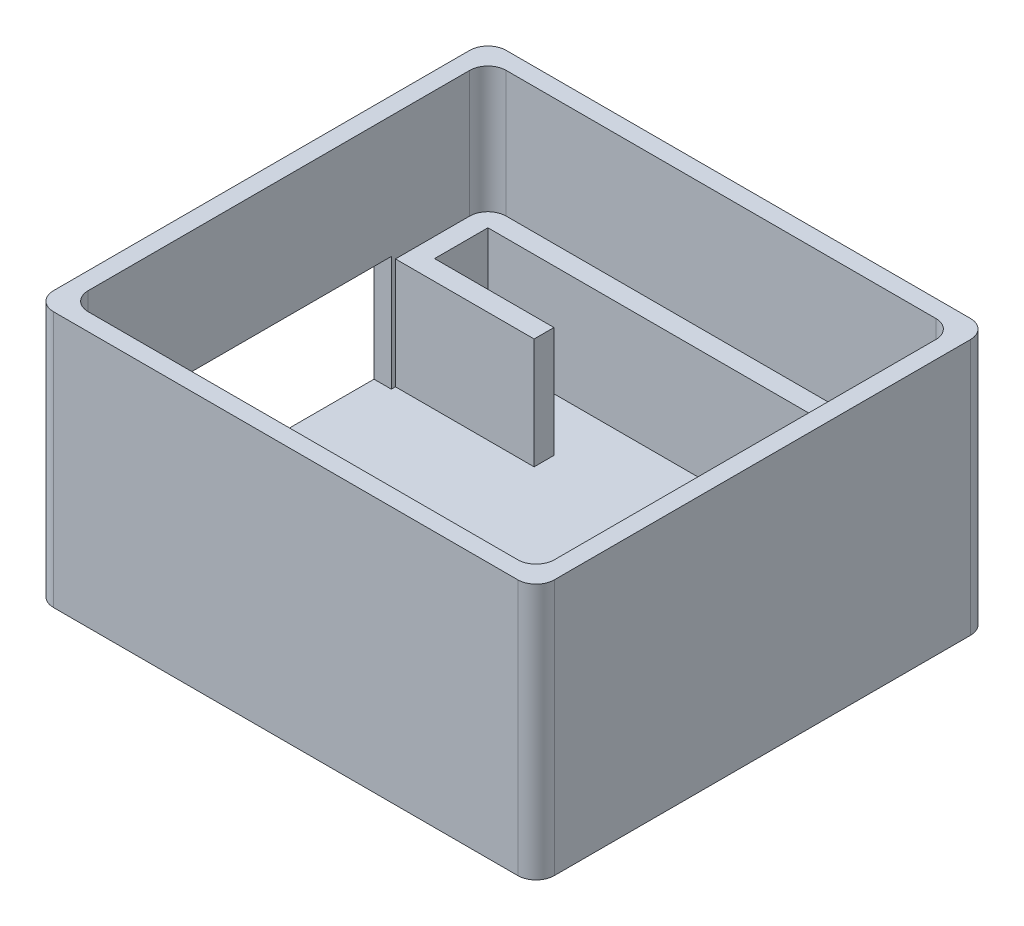
from build123d import *

# Parameters (mm, degrees)
SKETCH_1_W          = 26
SKETCH_1_H          = 23.5
SKETCH_1_W_2        = 24
SKETCH_1_H_2        = 21.5
EXTRUDE_1_DEPTH     = 10
SKETCH_2_W          = 12.504676962
SKETCH_2_H          = 3.66933463
CUT_EXTRUDE_1_DEPTH = 1
EXTRUDE_2_DEPTH     = 2.3
SKETCH_5_W          = 26
SKETCH_5_H          = 23.5
EXTRUDE_3_DEPTH     = 1
CUT_EXTRUDE_2_REACH = 38.168
SKETCH_6_W          = 24.2
SKETCH_6_H          = 21.7
SKETCH_6_W_2        = 24
SKETCH_6_H_2        = 21.5
SKETCH_7_W          = 22.2
SKETCH_7_H          = 1
SKETCH_7_W_2        = 1
SKETCH_7_H_2        = 19.7
SKETCH_7_W_3        = 6.19724131
SKETCH_7_H_3        = 1.03
SKETCH_7_W_4        = 6.2
EXTRUDE_4_DEPTH     = 5.75
FILLET_1_R          = 0.95


with BuildPart() as part:
    # 草图1 → 凸台-拉伸1 (new body)
    with BuildSketch(Plane(origin=(0, 0, 0), x_dir=(1, 0, 0), z_dir=(0, 1, 0))):
        with Locations((12, 10.75)):
            Rectangle(SKETCH_1_W, SKETCH_1_H)
        with Locations((12, 10.75)):
            Rectangle(SKETCH_1_W_2, SKETCH_1_H_2, mode=Mode.SUBTRACT)
    extrude(amount=EXTRUDE_1_DEPTH)

    # 草图2 → 切除-拉伸1 (cut)
    with BuildSketch(Plane.ZY.offset(1)):
        with Locations((-10.334237592, 1.834667315)):
            Rectangle(SKETCH_2_W, SKETCH_2_H)
    extrude(amount=-CUT_EXTRUDE_1_DEPTH, mode=Mode.SUBTRACT)

    # 草图3 → 凸台-拉伸2 (add)
    with BuildSketch(Plane.XZ):
        Polygon((-1, -4.081899111), (-1, 1), (25, 1), (25, -22.5), (-1, -22.5), (-1, -16.586576073), (0, -16.586576073), (0, -21.5), (24, -21.5), (24, 0), (0, 0), (0, -4.081899111), align=None)
    extrude(amount=EXTRUDE_2_DEPTH)

    # 草图5 → 凸台-拉伸3 (add)
    with BuildSketch(Plane.XZ.offset(2.3)):
        with Locations((12, -10.75)):
            Rectangle(SKETCH_5_W, SKETCH_5_H)
    extrude(amount=EXTRUDE_3_DEPTH)

    # 切除-拉伸2: up to this face of the body (flat: up to its plane)
    cut_extrude_2_end = Plane(part.part.faces().sort_by_distance((11.704243938, -2.3, -10.74016286))[0])
    # 草图6 → 切除-拉伸2 (cut, up to the picked face)
    with BuildSketch(Plane(origin=(0, 10, 0), x_dir=(1, 0, 0), z_dir=(0, 1, 0)), mode=Mode.PRIVATE) as cut_extrude_2_sk1:
        with Locations((12, 10.75)):
            Rectangle(SKETCH_6_W, SKETCH_6_H)
        with Locations((12, 10.75)):
            Rectangle(SKETCH_6_W_2, SKETCH_6_H_2, mode=Mode.SUBTRACT)
    cut_extrude_2_tool1 = split(extrude(cut_extrude_2_sk1.sketch, amount=-CUT_EXTRUDE_2_REACH, mode=Mode.PRIVATE), bisect_by=cut_extrude_2_end, keep=Keep.BOTH, mode=Mode.PRIVATE)
    add(cut_extrude_2_tool1.solids().sort_by(Axis((12, 10, -21.567496), (0, -1, 0)))[0], mode=Mode.SUBTRACT)

    # 草图7 → 凸台-拉伸4 (add)
    with BuildSketch(Plane(origin=(0, -2.3, 0), x_dir=(1, 0, 0), z_dir=(0, 1, 0))):
        with Locations((12, 21.1)):
            Rectangle(SKETCH_7_W, SKETCH_7_H)
        with Locations((0.4, 21.1)):
            Rectangle(SKETCH_7_W_2, SKETCH_7_H)
        Polygon((0.9, 20.6), (-0.1, 20.6), (-0.1, 16.8), (0.9, 16.8), (0.9, 17.83), align=None)
        with Locations((23.6, 21.1)):
            Rectangle(SKETCH_7_W_2, SKETCH_7_H)
        with Locations((23.6, 10.75)):
            Rectangle(SKETCH_7_W_2, SKETCH_7_H_2)
        with Locations((12, 0.4)):
            Rectangle(SKETCH_7_W, SKETCH_7_H)
        with Locations((23.6, 0.4)):
            Rectangle(SKETCH_7_W_2, SKETCH_7_H)
        with Locations((0.4, 0.4)):
            Rectangle(SKETCH_7_W_2, SKETCH_7_H)
        Polygon((-0.1, 0.9), (0.9, 0.9), (0.9, 3.081899111), (0.9, 4.081899111), (-0.1, 4.081899111), align=None)
        with Locations((3.998620655, 17.315)):
            Rectangle(SKETCH_7_W_3, SKETCH_7_H_3)
        with Locations((4, 3.581899111)):
            Rectangle(SKETCH_7_W_4, SKETCH_7_H)
    extrude(amount=EXTRUDE_4_DEPTH)

    # 圆角1
    fillet_1_edges = [part.edges().sort_by_distance(p)[0] for p in [
        (-0.1, 6.725, 0.1),
        (24.1, 6.725, 0.1),
        (24.1, 6.725, -21.6),
        (-0.1, 6.725, -21.6),
        (-1, 3.35, -22.5),
        (25, 3.35, -22.5),
        (25, 3.35, 1),
        (-1, 3.35, 1),
    ]]
    fillet(fillet_1_edges, radius=FILLET_1_R)


solid = part.part
